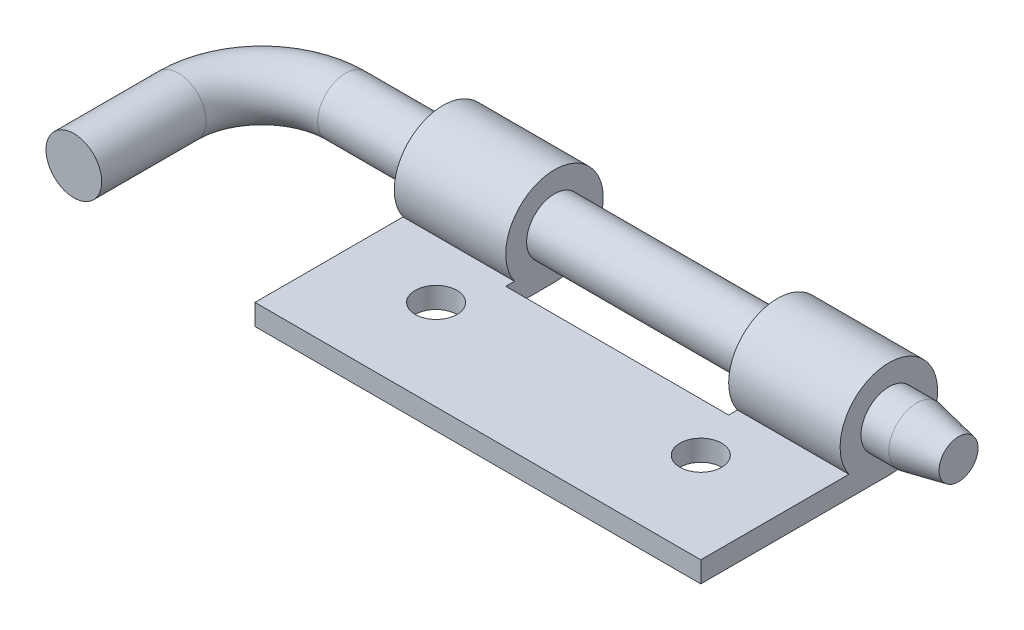
from build123d import *

# Parameters (mm, degrees)
SKETCH_6_R      = 3.5
EXTRUDE_4_DEPTH = 8
EXTRUDE_START   = -24
SKETCH_7_R      = 3.5
EXTRUDE_5_DEPTH = 8
EXTRUDE_START_2 = -3.5
SKETCH_8_R      = 1.5
EXTRUDE_6_DEPTH = 1.5
SKETCH_11_R     = 2


with BuildPart() as part:
    # 草图6 → 凸台-拉伸4 (new body)
    with BuildSketch(Plane(origin=(0, 0, 0), x_dir=(0, 0, -1), z_dir=(1, 0, 0))):
        Circle(SKETCH_6_R)
    extrude(amount=EXTRUDE_4_DEPTH)



with BuildPart() as body_2:
    # 草图7 → 凸台-拉伸5 (new body)
    with BuildSketch(Plane.ZY.offset(EXTRUDE_START)):
        with Locations(Location((0, 0, 0), (0, 0, 180))):
            Circle(SKETCH_7_R)
    extrude(amount=-EXTRUDE_5_DEPTH)


with BuildPart() as part_1:
    add(part.part)

    add(body_2.part)  # 凸台-拉伸6 merges body 2
    # 草图8 → 凸台-拉伸6 (add)
    with BuildSketch(Plane(origin=(0, 0, 0), x_dir=(1, 0, 0), z_dir=(0, 1, 0)).offset(EXTRUDE_START_2)):
        Polygon((0, 0), (8, 0), (8, -3.5), (24, -3.5), (24, 0), (32, 0), (32, -13.5), (0, -13.5), align=None)
        with Locations(Location((25.5, -7, 0), (0, 0, 270))):
            Circle(SKETCH_8_R, mode=Mode.SUBTRACT)
        with Locations(Location((6.5, -7, 0), (0, 0, 270))):
            Circle(SKETCH_8_R, mode=Mode.SUBTRACT)
    extrude(amount=EXTRUDE_6_DEPTH)

    # 扫描2: sweep along a path in 草图9
    with BuildLine(Plane(origin=(0, 0, 0), x_dir=(1, 0, 0), z_dir=(0, 1, 0))) as sweep_2_path:
        Line((37, 0), (-7, 0))
        ThreePointArc((-7, 0), (-11.242640687, -1.757359313), (-13, -6))
        Line((-13, -6), (-13, -13.5))
    # 草图11 → 扫描2 (sweep)
    with BuildSketch(Plane(origin=(37, 0, 0), x_dir=(0, 0, -1), z_dir=(1, 0, 0))):
        Circle(SKETCH_11_R)
    sweep(path=sweep_2_path.line)

    # 草图12 → 切除-旋转1 (revolve, cut)
    with BuildSketch(Plane(origin=(0, 0, 0), x_dir=(1, 0, 0), z_dir=(0, 1, 0)), mode=Mode.PRIVATE) as cut_revolve_1_sk:
        Polygon((37, 2), (37, 1.4), (34, 2), align=None)
    revolve(cut_revolve_1_sk.sketch.rotate(Axis((39.15439067, 0, 0), (1, 0, 0)), 180), axis=Axis((39.15439067, 0, 0), (1, 0, 0)), mode=Mode.SUBTRACT)


solid = part_1.part
